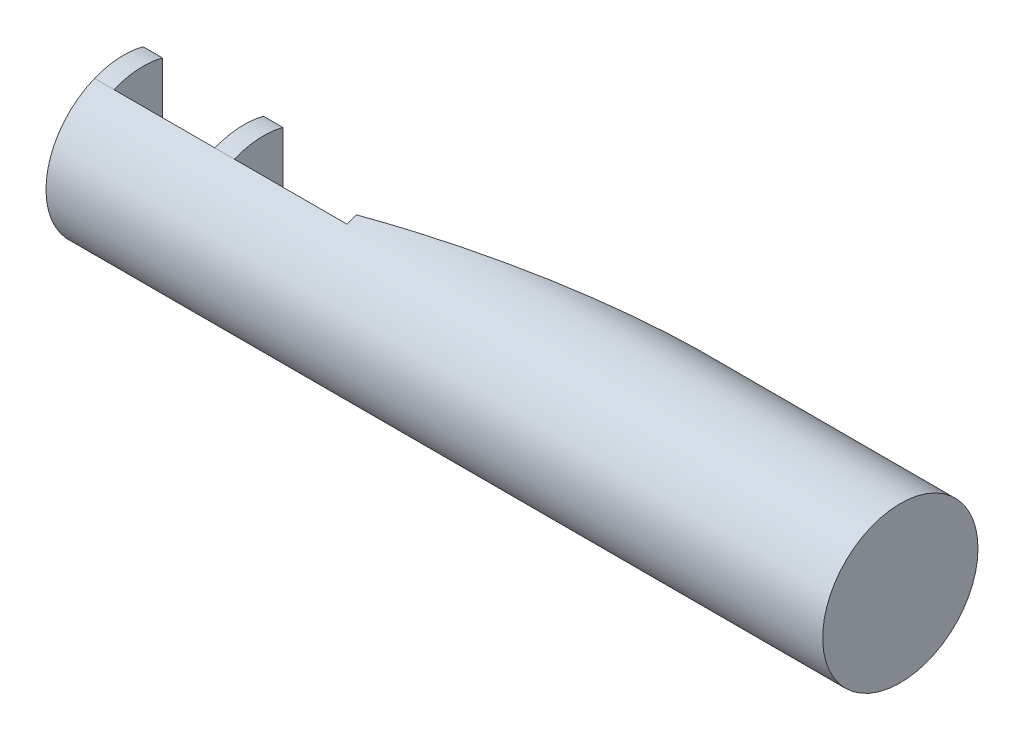
from build123d import *

# Parameters (mm, degrees)
SKETCH2_R               = 4
BOSS_EXTRUDE1_DEPTH     = 40
CUT_EXTRUDE2_DEPTH      = 1.5
CUT_EXTRUDE2_DEPTH_BACK = 4
SKETCH4_W               = 5.2
SKETCH4_H               = 9.371601823
SKETCH5_R               = 0.5
THREADS_DEPTH           = 5
CUT_EXTRUDE4_DEPTH      = 1.5
CUT_EXTRUDE4_DEPTH_BACK = 4
SKETCH6_W               = 5.8
SKETCH6_H               = 9.854187498
SKETCH8_W               = 10.763579103
SKETCH8_H               = 23.146515462
CUT_EXTRUDE6_DEPTH      = 15
CUT_EXTRUDE6_DRAFT      = -15
SKETCH11_W              = 3.996379664
SKETCH11_H              = 9.73653473
CUT_EXTRUDE10_DEPTH     = 9


with BuildPart() as part:
    # Sketch2 → Boss-Extrude1 (new body)
    with BuildSketch(Plane(origin=(0, 0, 0), x_dir=(0, 0, -1), z_dir=(1, 0, 0))):
        Circle(SKETCH2_R)
    extrude(amount=BOSS_EXTRUDE1_DEPTH)

    # Sketch4 → Cut-Extrude2 (cut, two sides: drawn at the far end of the back side and taken through both)
    with BuildSketch(Plane.XY.offset(-CUT_EXTRUDE2_DEPTH_BACK)):
        with Locations((3.6, 0.685800912)):
            Rectangle(SKETCH4_W, SKETCH4_H)
    extrude(amount=CUT_EXTRUDE2_DEPTH + CUT_EXTRUDE2_DEPTH_BACK, mode=Mode.SUBTRACT)

    # Sketch5 → Threads (cut)
    with BuildSketch(Plane.ZY):
        with Locations((0.3, 0.2)):
            Circle(SKETCH5_R)
        with Locations((0.3, -2.2)):
            Circle(SKETCH5_R)
    extrude(amount=-THREADS_DEPTH, mode=Mode.SUBTRACT)

    # Sketch6 → Cut-Extrude4 (cut, two sides: drawn at the far end of the back side and taken through both)
    with BuildSketch(Plane.XY.offset(-CUT_EXTRUDE4_DEPTH_BACK)):
        with Locations((10.1, 0.927093749)):
            Rectangle(SKETCH6_W, SKETCH6_H)
    extrude(amount=CUT_EXTRUDE4_DEPTH + CUT_EXTRUDE4_DEPTH_BACK, mode=Mode.SUBTRACT)


with BuildPart() as cut_extrude6_tool:
    # Sketch8 → Cut-Extrude6 (with draft: the straight prism first)
    with BuildSketch(Plane.ZY.offset(-13)):
        with Locations((-4.378859443, -1.192602159)):
            Rectangle(SKETCH8_W, SKETCH8_H)
    extrude(amount=-CUT_EXTRUDE6_DEPTH)
    # Cut-Extrude6: the draft: its side faces are tilted about the plane it starts from
    cut_extrude6_sides = [cut_extrude6_tool.faces().sort_by_distance(p)[0] for p in [
        (20.5, 10.380655572, -4.378859443),
        (20.5, -1.192602159, -9.760648994),
        (20.5, -12.76585989, -4.378859443),
        (20.5, -1.192602159, 1.002930109),
    ]]
    draft(cut_extrude6_sides, Plane.ZY.offset(-13), CUT_EXTRUDE6_DRAFT)


with BuildPart() as part_1:
    add(part.part)

    # Cut-Extrude6: cut by cut_extrude6_tool
    add(cut_extrude6_tool.part, mode=Mode.SUBTRACT)

    # Sketch11 → Cut-Extrude10 (cut)
    with BuildSketch(Plane.ZY):
        with Locations((-2.998189832, -0.287985871)):
            Rectangle(SKETCH11_W, SKETCH11_H)
    extrude(amount=-CUT_EXTRUDE10_DEPTH, mode=Mode.SUBTRACT)


solid = part_1.part
